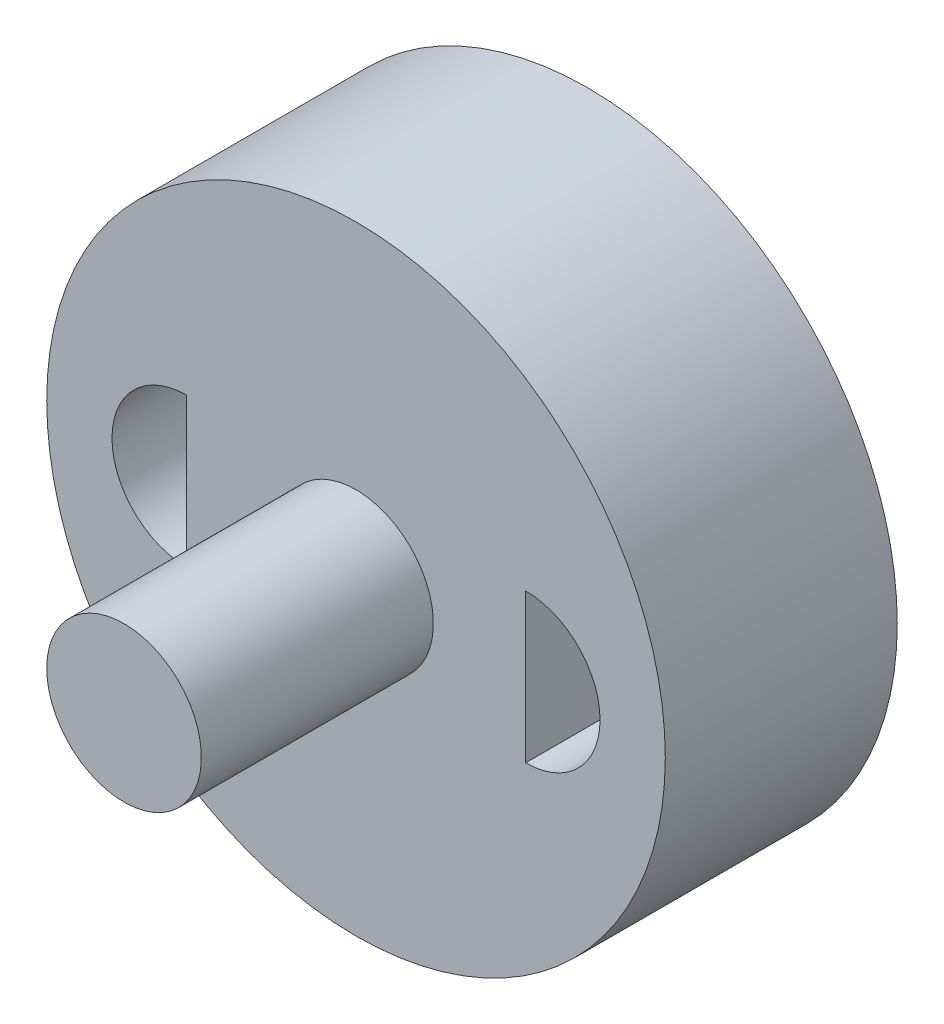
from build123d import *

# Parameters (mm, degrees)
SKETCH1_R               = 101.6
BOSS_EXTRUDE1_DEPTH     = 76.2
CUT_EXTRUDE7_DEPTH      = 163.639355631
CUT_EXTRUDE7_DEPTH_BACK = 163.639355631
SKETCH3_R               = 25.4
BOSS_EXTRUDE2_DEPTH     = 76.2


with BuildPart() as part:
    # Sketch1 → Boss-Extrude1 (new body)
    with BuildSketch(Plane.XY):
        with Locations(Location((0, 0, 0), (0, 0, 180))):
            Circle(SKETCH1_R)
    extrude(amount=BOSS_EXTRUDE1_DEPTH)

    # Sketch2 → Cut-Extrude7 (cut, two sides: drawn at the far end of the back side and taken through both)
    with BuildSketch(Plane.XY.offset(76.2).offset(-CUT_EXTRUDE7_DEPTH_BACK)):
        with BuildLine():
            ThreePointArc((-55.703026842, -24.462175809), (-80.165202651, 0), (-55.703026842, 24.462175809))
            Line((-55.703026842, 24.462175809), (-55.703026842, -24.462175809))
        make_face()
        with BuildLine():
            Line((55.703026842, 24.462175809), (55.703026842, -24.462175809))
            ThreePointArc((55.703026842, -24.462175809), (80.165202651, 0), (55.703026842, 24.462175809))
        make_face()
    extrude(amount=CUT_EXTRUDE7_DEPTH + CUT_EXTRUDE7_DEPTH_BACK, mode=Mode.SUBTRACT)

    # Sketch3 → Boss-Extrude2 (add)
    with BuildSketch(Plane.XY.offset(76.2)):
        with Locations(Location((0, 0, 0), (0, 0, 180))):
            Circle(SKETCH3_R)
    extrude(amount=BOSS_EXTRUDE2_DEPTH)


solid = part.part
